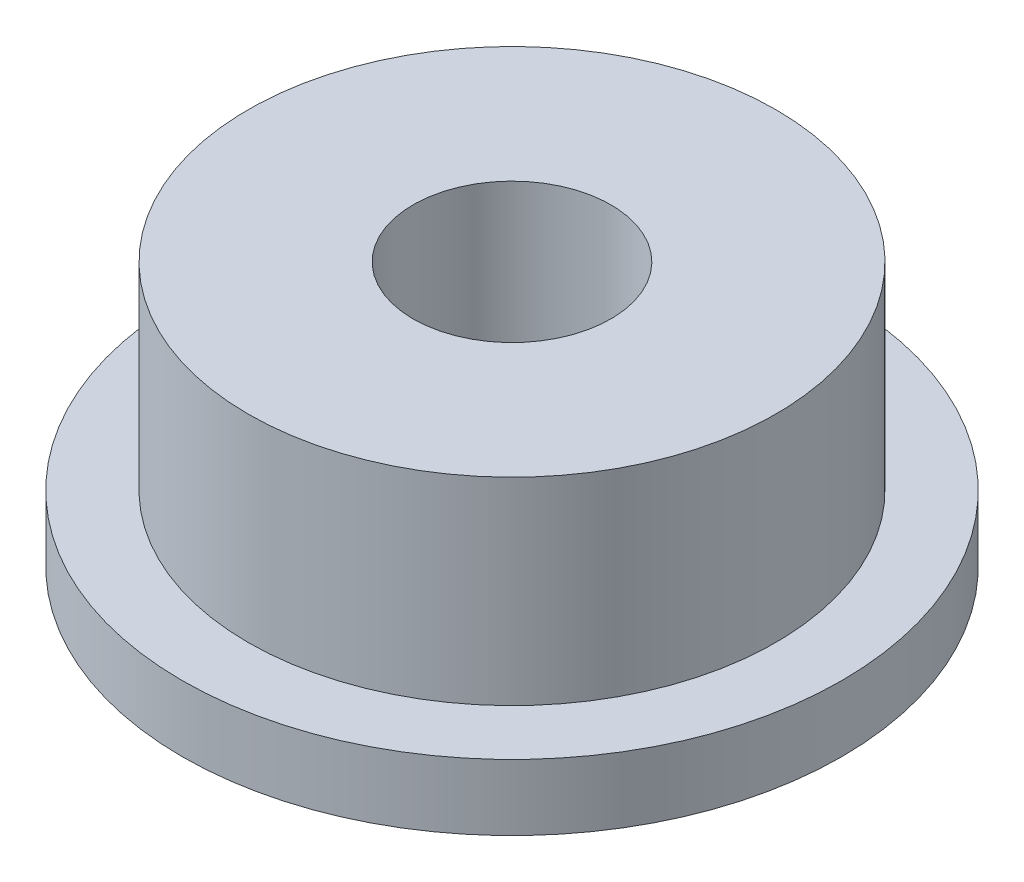
from build123d import *


with BuildPart() as part:
    # 草图1 → 旋转1 (revolve)
    with BuildSketch(Plane.XY, mode=Mode.PRIVATE) as revolve_1_sk:
        Polygon((1.5, -4), (1.5, 0), (4, 0), (4, -3), (5, -3), (5, -4), align=None)
    revolve(revolve_1_sk.sketch.rotate(Axis((0, 0, 0), (0, -1, 0)), 90), axis=Axis((0, 0, 0), (0, -1, 0)))


solid = part.part
